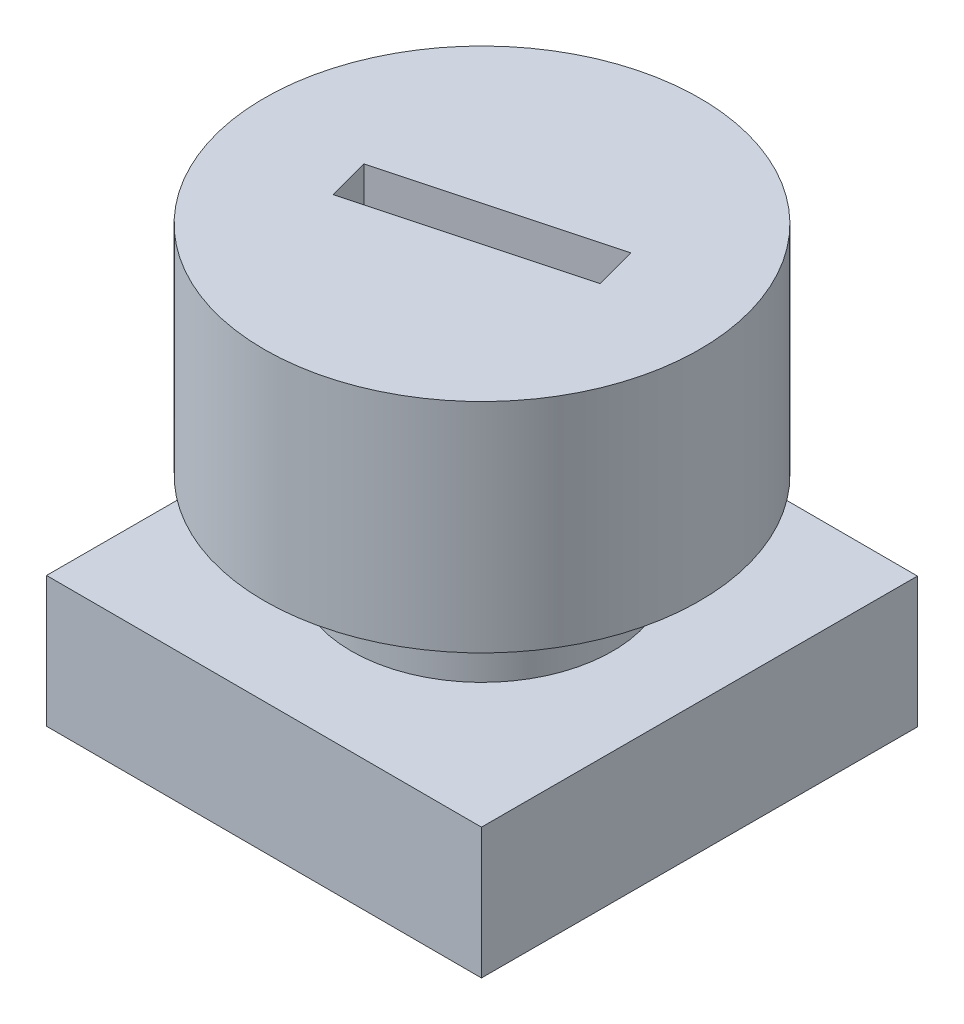
from build123d import *

# Parameters (mm, degrees)
SKETCH_1_R          = 5
EXTRUDE_1_DEPTH     = 5
SKETCH_3_R          = 3
EXTRUDE_2_DEPTH     = 2
EXTRUDE_3_DEPTH     = 3
SKETCH_5_R          = 2.5
CUT_EXTRUDE_2_DEPTH = 6
CUT_EXTRUDE_1_DEPTH = 3


with BuildPart() as part:
    # 草图1 → 凸台-拉伸1 (new body)
    with BuildSketch(Plane(origin=(0, 0, 0), x_dir=(1, 0, 0), z_dir=(0, 1, 0))):
        with Locations(Location((0, 0, 0), (0, 0, 270))):
            Circle(SKETCH_1_R)
    extrude(amount=EXTRUDE_1_DEPTH)

    # 草图3 → 凸台-拉伸2 (add)
    with BuildSketch(Plane.XZ):
        with Locations(Location((0, 0, 0), (0, 0, 90))):
            Circle(SKETCH_3_R)
    extrude(amount=EXTRUDE_2_DEPTH)

    # 草图4 → 凸台-拉伸3 (add)
    with BuildSketch(Plane.XZ.offset(2)):
        Polygon((4.993690859, 5.00630119), (-5.00630119, 4.993690859), (-4.993690859, -5.00630119), (5.00630119, -4.993690859), align=None)
    extrude(amount=EXTRUDE_3_DEPTH)

    # 草图5 → 切除-拉伸2 (cut)
    with BuildSketch(Plane.XZ.offset(5)):
        with Locations(Location((0, 0, 0), (0, 0, 270))):
            Circle(SKETCH_5_R)
    extrude(amount=-CUT_EXTRUDE_2_DEPTH, mode=Mode.SUBTRACT)

    # 草图2 → 切除-拉伸1 (cut)
    with BuildSketch(Plane(origin=(0, 5, 0), x_dir=(1, 0, 0), z_dir=(0, 1, 0))):
        Polygon((-2.285405043, -1.130010526), (2.544224088, 0.1640847), (2.285405043, 1.130010526), (-2.544224088, -0.1640847), align=None)
    extrude(amount=-CUT_EXTRUDE_1_DEPTH, mode=Mode.SUBTRACT)


solid = part.part
